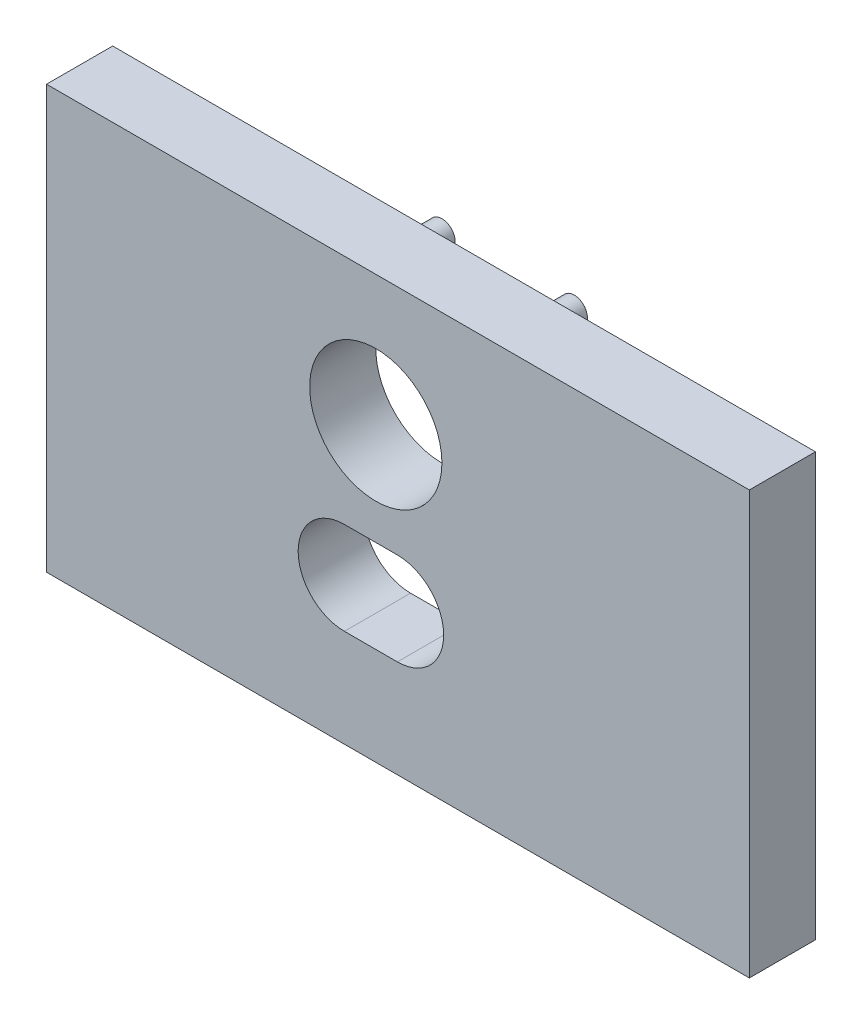
from build123d import *

# Parameters (mm, degrees)
SKETCH_1_W          = 53.133435949
SKETCH_1_H          = 31.954374066
EXTRUDE_1_DEPTH     = 5
SKETCH_13_R         = 5
CUT_EXTRUDE_3_DEPTH = 10
SKETCH_14_R         = 1
EXTRUDE_8_DEPTH     = 5
CUT_EXTRUDE_4_DEPTH = 5


with BuildPart() as part:
    # Sketch 1 → 凸台-拉伸1 (new body)
    with BuildSketch(Plane.XY):
        with Locations((-14.305155832, 15.512733922)):
            Rectangle(SKETCH_1_W, SKETCH_1_H)
    extrude(amount=EXTRUDE_1_DEPTH)

    # 草图13 → 切除-拉伸3 (cut)
    with BuildSketch(Plane.XY.offset(5)):
        with Locations((-15.979181362, 21.631548394)):
            Circle(SKETCH_13_R)
    extrude(amount=-CUT_EXTRUDE_3_DEPTH, mode=Mode.SUBTRACT)

    # 草图14 → 凸台-拉伸8 (add)
    with BuildSketch(Plane(origin=(0, 0, 0), x_dir=(-1, 0, 0), z_dir=(0, 0, -1))):
        with Locations(Location((10.979181362, 26.631548394, 0), (0, 0, 180))):
            Circle(SKETCH_14_R)
        with Locations(Location((20.979181362, 26.631548394, 0), (0, 0, 180))):
            Circle(SKETCH_14_R)
    extrude(amount=EXTRUDE_8_DEPTH)

    # 草图15 → 切除-拉伸4 (cut)
    with BuildSketch(Plane.XY.offset(5)):
        with BuildLine():
            Line((-18.349316934, 13.92753167), (-14.349316934, 13.92753167))
            ThreePointArc((-14.349316934, 13.92753167), (-10.849316934, 10.42753167), (-14.349316934, 6.92753167))
            Line((-14.349316934, 6.92753167), (-18.349316934, 6.92753167))
            ThreePointArc((-18.349316934, 6.92753167), (-21.849316934, 10.42753167), (-18.349316934, 13.92753167))
        make_face()
    extrude(amount=-CUT_EXTRUDE_4_DEPTH, mode=Mode.SUBTRACT)


solid = part.part
